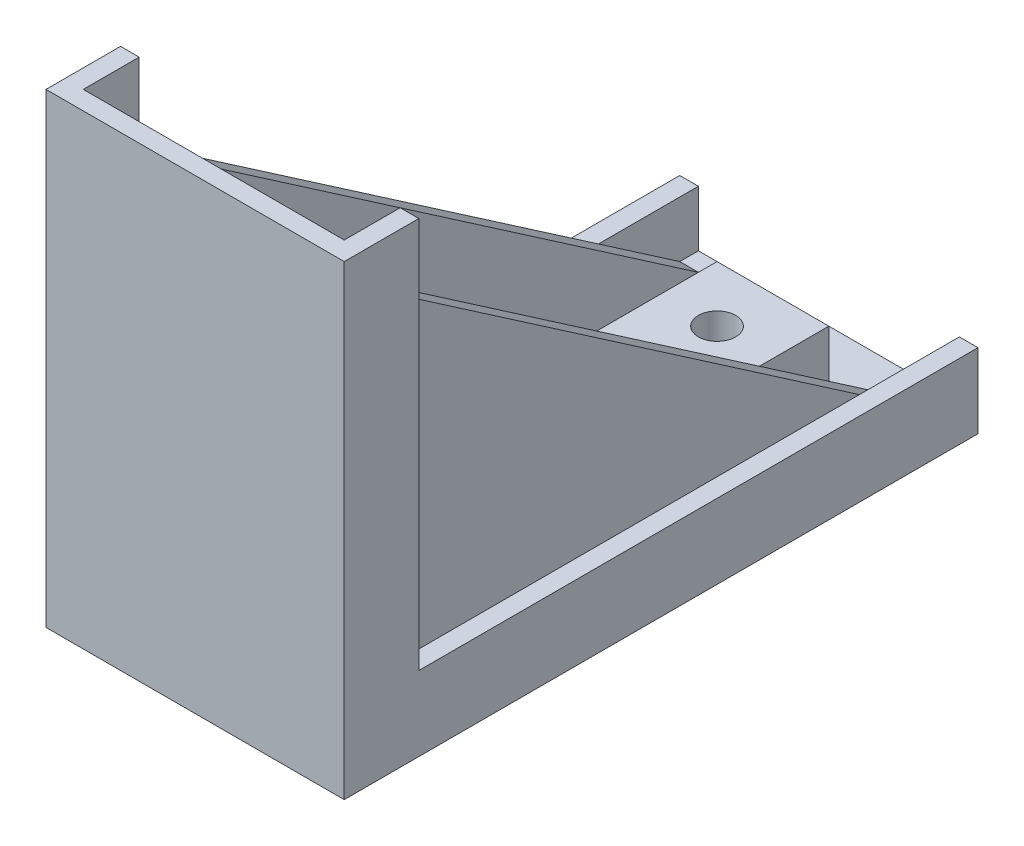
from build123d import *

# Parameters (mm, degrees)
BOSS_EXTRUDE1_DEPTH     = 31.25
BOSS_EXTRUDE2_DEPTH     = 41.25
BOSS_EXTRUDE3_DEPTH     = 1.25
SKETCH6_W               = 7.5
SKETCH6_H               = 22.5
SKETCH6_R               = 1.25
BOSS_EXTRUDE4_DEPTH     = 3.75
CUT_EXTRUDE1_DEPTH      = 53.974050251
CUT_EXTRUDE1_DEPTH_BACK = 53.974050251
SKETCH6_2_R             = 1.25


with BuildPart() as part:
    # Sketch1 → Boss-Extrude1 (new body)
    with BuildSketch(Plane(origin=(0, 0, 0), x_dir=(1, 0, 0), z_dir=(0, 1, 0))):
        Polygon((-10, 0), (10, 0), (10, 5), (8.75, 5), (8.75, 1.25), (-8.75, 1.25), (-8.75, 5), (-10, 5), align=None)
    extrude(amount=BOSS_EXTRUDE1_DEPTH)

    # Sketch2 → Boss-Extrude2 (add)
    with BuildSketch(Plane(origin=(0, 0, -1.25), x_dir=(-1, 0, 0), z_dir=(0, 0, -1))):
        Polygon((-10, 5), (-10, 0), (10, 0), (10, 5), (8.75, 5), (8.75, 1.25), (-8.75, 1.25), (-8.75, 5), align=None)
    extrude(amount=BOSS_EXTRUDE2_DEPTH)

    # Sketch4 → Boss-Extrude3 (add)
    with BuildSketch(Plane(origin=(7.5, 0, 0), x_dir=(0, 0, -1), z_dir=(1, 0, 0))):
        Polygon((1.25, 28.75), (1.25, 1.25), (41.25, 1.25), align=None)
    boss_extrude3 = extrude(amount=BOSS_EXTRUDE3_DEPTH)

    # Mirror1: Boss-Extrude3 across plane
    add(boss_extrude3.mirror(Plane(origin=(0, 0, 0), x_dir=(0, 0, 1), z_dir=(1, 0, 0))))

    # Sketch6 → Boss-Extrude4 (add)
    with BuildSketch(Plane(origin=(0, 1.25, 0), x_dir=(1, 0, 0), z_dir=(0, 1, 0))):
        with Locations((0, 27.5)):
            Rectangle(SKETCH6_W, SKETCH6_H)
        with Locations((0, 35)):
            Circle(SKETCH6_R, mode=Mode.SUBTRACT)
        with Locations((0, 25)):
            Circle(SKETCH6_R, mode=Mode.SUBTRACT)
    extrude(amount=BOSS_EXTRUDE4_DEPTH)

    # Sketch6<2> → Cut-Extrude1 (cut, two sides: drawn at the far end of the back side and taken through both)
    with BuildSketch(Plane(origin=(0, 1.25, 0), x_dir=(1, 0, 0), z_dir=(0, 1, 0)).offset(-CUT_EXTRUDE1_DEPTH_BACK)):
        with Locations((0, 35)):
            Circle(SKETCH6_2_R)
        with Locations((0, 25)):
            Circle(SKETCH6_2_R)
    extrude(amount=CUT_EXTRUDE1_DEPTH + CUT_EXTRUDE1_DEPTH_BACK, mode=Mode.SUBTRACT)


solid = part.part
